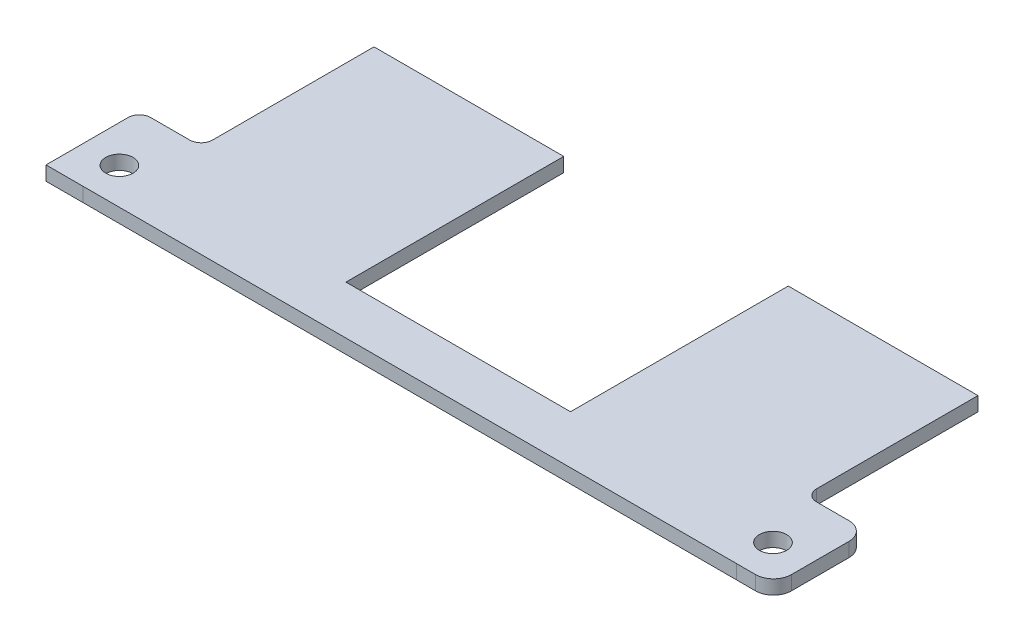
from build123d import *

# Parameters (mm, degrees)
SKETCH1_R           = 1.524000008
SKETCH1_R_2         = 1.523999992
BOSS_EXTRUDE1_DEPTH = 1.575


with BuildPart() as part:
    # Sketch1 → Boss-Extrude1 (new body)
    with BuildSketch(Plane(origin=(0, 0, 0), x_dir=(1, 0, 0), z_dir=(0, 1, 0))):
        with BuildLine():
            Line((38.851293305, -40.014412246), (36.727293315, -40.014412246))
            Line((36.727293315, -40.014412246), (36.727293315, -40.012412246))
            Line((36.727293315, -40.012412246), (30.377293307, -40.012412246))
            Line((30.377293307, -40.012412246), (-29.674706693, -40.012412246))
            Line((-29.674706693, -40.012412246), (-36.024706701, -40.012412246))
            Line((-36.024706701, -40.012412246), (-36.024706701, -40.014412246))
            Line((-36.024706701, -40.014412246), (-40.148706691, -40.014412246))
            Line((-40.148706691, -40.014412246), (-40.148706691, -30.885946892))
            ThreePointArc((-40.148706691, -30.885946892), (-39.776732303, -29.98792128), (-38.878706691, -29.615946892))
            Line((-38.878706691, -29.615946892), (-34.543706691, -29.615946892))
            ThreePointArc((-34.543706691, -29.615946892), (-33.645681079, -29.243972504), (-33.273706691, -28.345946892))
            Line((-33.273706691, -28.345946892), (-33.273706691, -10.370428445))
            Line((-33.273706691, -10.370428445), (-12.148706691, -10.370428445))
            Line((-12.148706691, -10.370428445), (-12.148706691, -17.871301308))
            Line((-12.148706691, -17.871301308), (-12.148706691, -34.615947016))
            Line((-12.148706691, -34.615947016), (12.851293309, -34.615947016))
            Line((12.851293309, -34.615947016), (12.851293309, -17.871301308))
            Line((12.851293309, -17.871301308), (12.851293309, -10.370428445))
            Line((12.851293309, -10.370428445), (33.976293305, -10.370428445))
            Line((33.976293305, -10.370428445), (33.976293305, -28.345946892))
            ThreePointArc((33.976293305, -28.345946892), (34.348267693, -29.243972504), (35.246293305, -29.615946892))
            Line((35.246293305, -29.615946892), (38.851293305, -29.615946892))
            ThreePointArc((38.851293305, -29.615946892), (40.265506868, -30.20173333), (40.851293305, -31.615946892))
            Line((40.851293305, -31.615946892), (40.851293305, -38.014412246))
            ThreePointArc((40.851293305, -38.014412246), (40.265506868, -39.428625809), (38.851293305, -40.014412246))
        make_face()
        with Locations(Location((-36.024706701, -35.965946892, 0), (0, 0, 270))):
            Circle(SKETCH1_R, mode=Mode.SUBTRACT)
        with Locations(Location((36.727293315, -35.947946892, 0), (0, 0, 270))):
            Circle(SKETCH1_R_2, mode=Mode.SUBTRACT)
    extrude(amount=BOSS_EXTRUDE1_DEPTH)


solid = part.part
